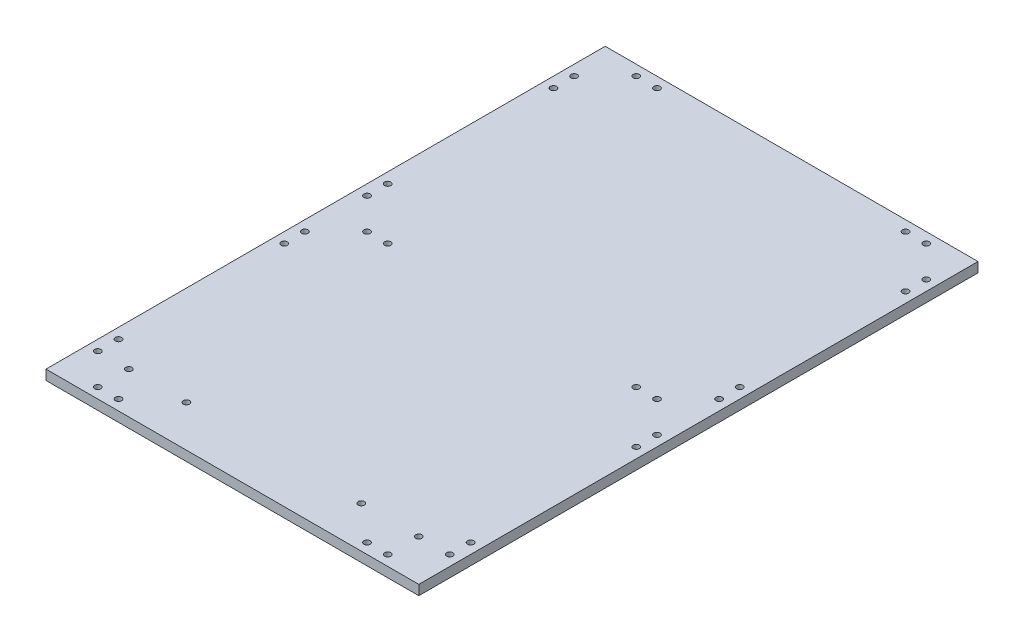
from build123d import *

# Parameters (mm, degrees)
SKETCH1_W             = 360
SKETCH1_H             = 540
BOSS_EXTRUDE1_DEPTH   = 9.525
F_6_0MM_DOWEL_HOLE1_D = 6
F_6_0MM_DOWEL_HOLE2_D = 6


with BuildPart() as part:
    # Sketch1 → Boss-Extrude1 (new body)
    with BuildSketch(Plane(origin=(0, 0, 0), x_dir=(1, 0, 0), z_dir=(0, 1, 0))):
        with Locations((180, 270)):
            Rectangle(SKETCH1_W, SKETCH1_H)
    extrude(amount=BOSS_EXTRUDE1_DEPTH)

    # Ø6.0mm Dowel Hole1 (through all)
    with Locations(Plane(origin=(0, 9.525, 0), x_dir=(1, 0, 0), z_dir=(0, 1, 0))):
        with Locations((40, 40), (95.5625, 40), (264.4375, 40), (320, 40)):
            Hole(F_6_0MM_DOWEL_HOLE1_D / 2)

    # Ø6.0mm Dowel Hole2 (through all)
    with Locations(Plane(origin=(0, 9.525, 0), x_dir=(1, 0, 0), z_dir=(0, 1, 0))):
        with Locations((40, 10), (10, 40), (320, 10), (350, 40), (10, 240), (40, 270), (10, 300), (350, 240), (320, 270), (350, 300), (10, 500), (40, 530), (320, 530), (350, 500), (10, 480), (60, 530), (300, 530), (350, 480), (350, 320), (300, 270), (350, 220), (10, 220), (60, 270), (10, 320), (10, 60), (60, 10), (300, 10), (350, 60)):
            Hole(F_6_0MM_DOWEL_HOLE2_D / 2)


solid = part.part
